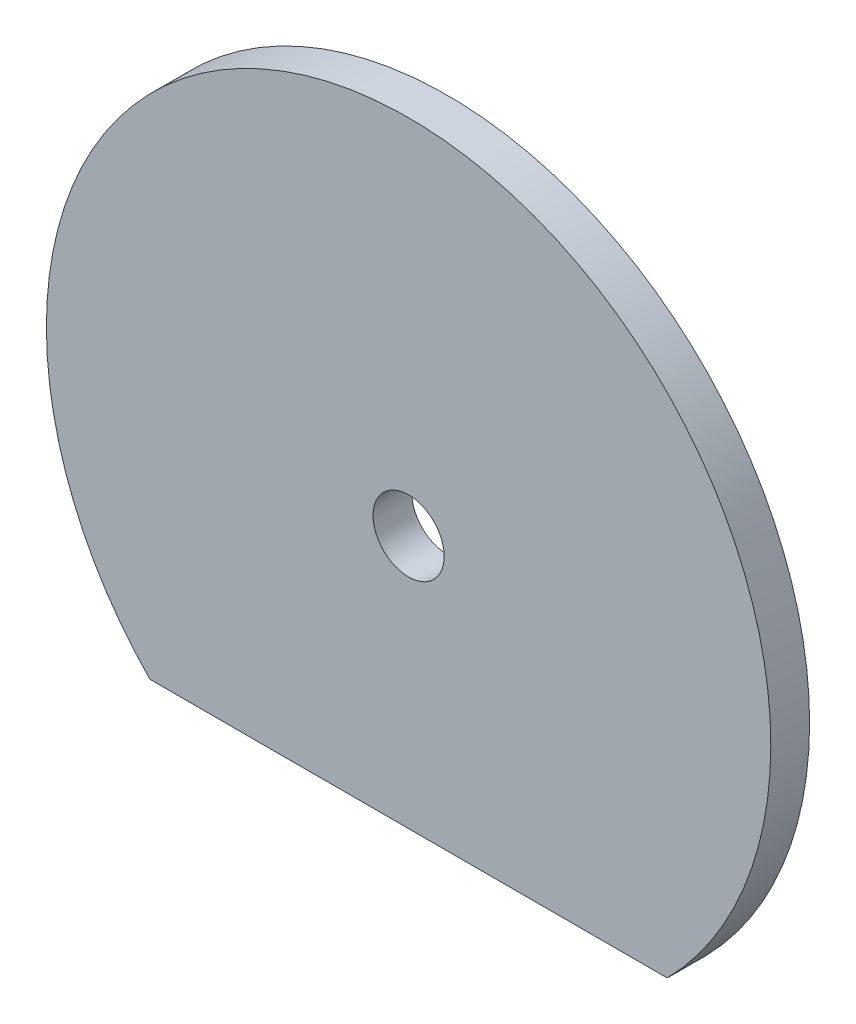
from build123d import *

# Parameters (mm, degrees)
BOSS_EXTRUDE1_DEPTH = 3
SKETCH2_R           = 2.75
CUT_EXTRUDE1_DEPTH  = 10


with BuildPart() as part:
    # Sketch1 → Boss-Extrude1 (new body)
    with BuildSketch(Plane.XY):
        with BuildLine():
            Line((0, 0), (40, 0))
            ThreePointArc((40, 0), (20, 47.595917942), (0, 0))
        make_face()
    extrude(amount=BOSS_EXTRUDE1_DEPTH)

    # Sketch2 → Cut-Extrude1 (cut)
    with BuildSketch(Plane.XY.offset(3)):
        with Locations((20, 19.595917942)):
            Circle(SKETCH2_R)
    extrude(amount=-CUT_EXTRUDE1_DEPTH, mode=Mode.SUBTRACT)


solid = part.part
